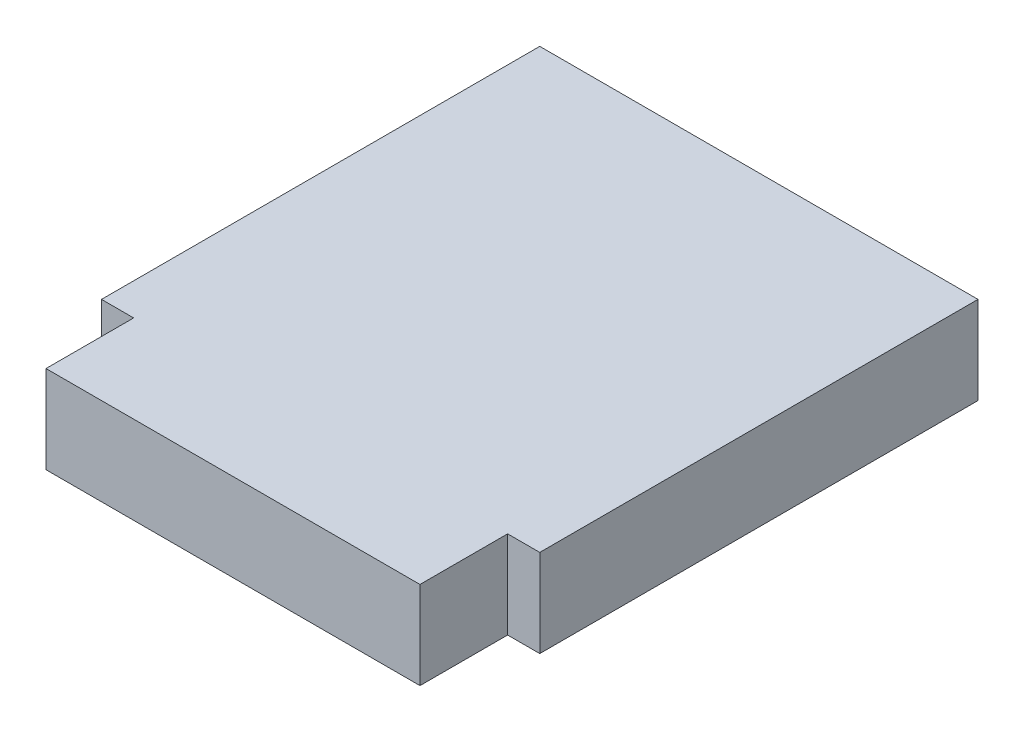
from build123d import *

# Parameters (mm, degrees)
BOSS_EXTRUDE1_DEPTH = 3


with BuildPart() as part:
    # Sketch1 → Boss-Extrude1 (new body)
    with BuildSketch(Plane(origin=(0, 0, 0), x_dir=(1, 0, 0), z_dir=(0, 1, 0))):
        Polygon((12.8, 3), (13.9, 3), (13.9, 18), (-1.1, 18), (-1.1, 3), (0, 3), (0, 0), (12.8, 0), align=None)
    extrude(amount=BOSS_EXTRUDE1_DEPTH)


solid = part.part
